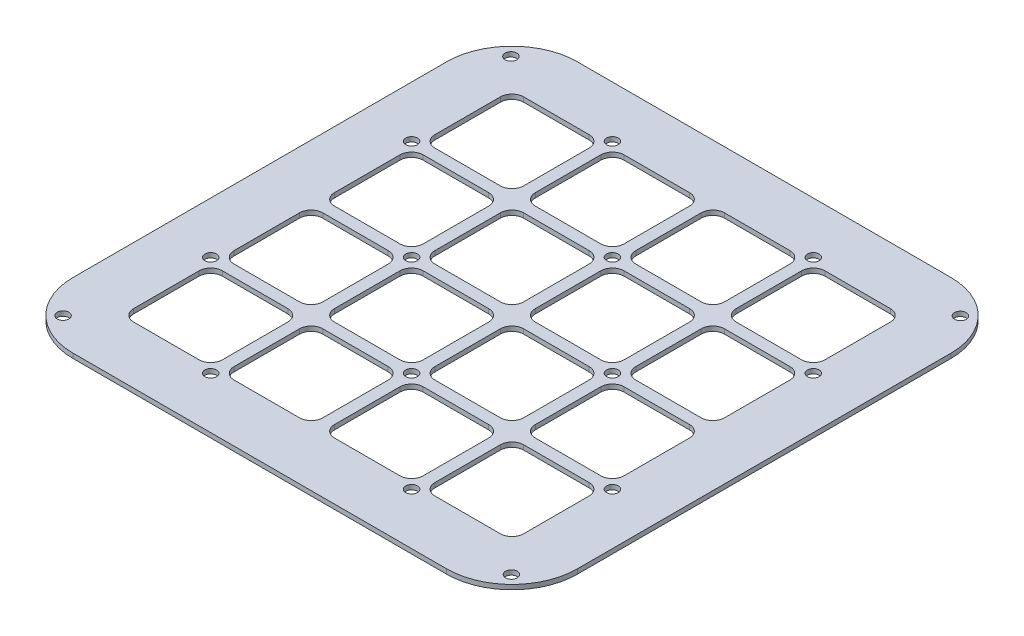
from build123d import *

# Parameters (mm, degrees)
BOSS_EXTRUDE1_DEPTH = 2
CUT_EXTRUDE1_REACH  = 154.836
SKETCH2_R           = 2.5
CUT_EXTRUDE3_REACH  = 154.836
SKETCH3_R           = 2.5


with BuildPart() as part:
    # Sketch1 → Boss-Extrude1 (new body)
    with BuildSketch(Plane(origin=(0, 0, 0), x_dir=(1, 0, 0), z_dir=(0, 1, 0))):
        with BuildLine():
            Line((80, 108.124355158), (-80, 108.124355158))
            ThreePointArc((-80, 108.124355158), (-99.798989873, 99.923345032), (-108, 80.124355158))
            Line((-108, 80.124355158), (-108, 70.124355158))
            Line((-108, 70.124355158), (-108, -79.875644842))
            ThreePointArc((-108, -79.875644842), (-99.798989873, -99.674634715), (-80, -107.875644842))
            Line((-80, -107.875644842), (80, -107.875644842))
            ThreePointArc((80, -107.875644842), (99.798989873, -99.674634715), (108, -79.875644842))
            Line((108, -79.875644842), (108, 70.124355158))
            Line((108, 70.124355158), (108, 80.124355158))
            ThreePointArc((108, 80.124355158), (99.798989873, 99.923345032), (80, 108.124355158))
        make_face()
        with BuildLine():
            Line((-35.5, 83.624355158), (-7.5, 83.624355158))
            ThreePointArc((-7.5, 83.624355158), (-3.964466094, 82.159889064), (-2.5, 78.624355158))
            Line((-2.5, 78.624355158), (-2.5, 50.624355158))
            ThreePointArc((-2.5, 50.624355158), (-3.964466094, 47.088821252), (-7.5, 45.624355158))
            Line((-7.5, 45.624355158), (-35.5, 45.624355158))
            ThreePointArc((-35.5, 45.624355158), (-39.035533906, 47.088821252), (-40.5, 50.624355158))
            Line((-40.5, 50.624355158), (-40.5, 78.624355158))
            ThreePointArc((-40.5, 78.624355158), (-39.035533906, 82.159889064), (-35.5, 83.624355158))
        make_face(mode=Mode.SUBTRACT)
        with BuildLine():
            Line((7.5, 83.624355158), (35.5, 83.624355158))
            ThreePointArc((35.5, 83.624355158), (39.035533906, 82.159889064), (40.5, 78.624355158))
            Line((40.5, 78.624355158), (40.5, 50.624355158))
            ThreePointArc((40.5, 50.624355158), (39.035533906, 47.088821252), (35.5, 45.624355158))
            Line((35.5, 45.624355158), (7.5, 45.624355158))
            ThreePointArc((7.5, 45.624355158), (3.964466094, 47.088821252), (2.5, 50.624355158))
            Line((2.5, 50.624355158), (2.5, 78.624355158))
            ThreePointArc((2.5, 78.624355158), (3.964466094, 82.159889064), (7.5, 83.624355158))
        make_face(mode=Mode.SUBTRACT)
        with BuildLine():
            Line((-78.5, 83.624355158), (-50.5, 83.624355158))
            ThreePointArc((-50.5, 83.624355158), (-46.964466094, 82.159889064), (-45.5, 78.624355158))
            Line((-45.5, 78.624355158), (-45.5, 50.624355158))
            ThreePointArc((-45.5, 50.624355158), (-46.964466094, 47.088821252), (-50.5, 45.624355158))
            Line((-50.5, 45.624355158), (-78.5, 45.624355158))
            ThreePointArc((-78.5, 45.624355158), (-82.035533906, 47.088821252), (-83.5, 50.624355158))
            Line((-83.5, 50.624355158), (-83.5, 78.624355158))
            ThreePointArc((-83.5, 78.624355158), (-82.035533906, 82.159889064), (-78.5, 83.624355158))
        make_face(mode=Mode.SUBTRACT)
        with BuildLine():
            Line((50.5, 83.624355158), (78.5, 83.624355158))
            ThreePointArc((78.5, 83.624355158), (82.035533906, 82.159889064), (83.5, 78.624355158))
            Line((83.5, 78.624355158), (83.5, 50.624355158))
            ThreePointArc((83.5, 50.624355158), (82.035533906, 47.088821252), (78.5, 45.624355158))
            Line((78.5, 45.624355158), (50.5, 45.624355158))
            ThreePointArc((50.5, 45.624355158), (46.964466094, 47.088821252), (45.5, 50.624355158))
            Line((45.5, 50.624355158), (45.5, 78.624355158))
            ThreePointArc((45.5, 78.624355158), (46.964466094, 82.159889064), (50.5, 83.624355158))
        make_face(mode=Mode.SUBTRACT)
        with BuildLine():
            Line((-35.5, 40.624355158), (-7.5, 40.624355158))
            ThreePointArc((-7.5, 40.624355158), (-3.964466094, 39.159889064), (-2.5, 35.624355158))
            Line((-2.5, 35.624355158), (-2.5, 7.624355158))
            ThreePointArc((-2.5, 7.624355158), (-3.964466094, 4.088821252), (-7.5, 2.624355158))
            Line((-7.5, 2.624355158), (-35.5, 2.624355158))
            ThreePointArc((-35.5, 2.624355158), (-39.035533906, 4.088821252), (-40.5, 7.624355158))
            Line((-40.5, 7.624355158), (-40.5, 35.624355158))
            ThreePointArc((-40.5, 35.624355158), (-39.035533906, 39.159889064), (-35.5, 40.624355158))
        make_face(mode=Mode.SUBTRACT)
        with BuildLine():
            Line((7.5, 40.624355158), (35.5, 40.624355158))
            ThreePointArc((35.5, 40.624355158), (39.035533906, 39.159889064), (40.5, 35.624355158))
            Line((40.5, 35.624355158), (40.5, 7.624355158))
            ThreePointArc((40.5, 7.624355158), (39.035533906, 4.088821252), (35.5, 2.624355158))
            Line((35.5, 2.624355158), (7.5, 2.624355158))
            ThreePointArc((7.5, 2.624355158), (3.964466094, 4.088821252), (2.5, 7.624355158))
            Line((2.5, 7.624355158), (2.5, 35.624355158))
            ThreePointArc((2.5, 35.624355158), (3.964466094, 39.159889064), (7.5, 40.624355158))
        make_face(mode=Mode.SUBTRACT)
        with BuildLine():
            Line((50.5, 40.624355158), (78.5, 40.624355158))
            ThreePointArc((78.5, 40.624355158), (82.035533906, 39.159889064), (83.5, 35.624355158))
            Line((83.5, 35.624355158), (83.5, 7.624355158))
            ThreePointArc((83.5, 7.624355158), (82.035533906, 4.088821252), (78.5, 2.624355158))
            Line((78.5, 2.624355158), (50.5, 2.624355158))
            ThreePointArc((50.5, 2.624355158), (46.964466094, 4.088821252), (45.5, 7.624355158))
            Line((45.5, 7.624355158), (45.5, 35.624355158))
            ThreePointArc((45.5, 35.624355158), (46.964466094, 39.159889064), (50.5, 40.624355158))
        make_face(mode=Mode.SUBTRACT)
        with BuildLine():
            Line((-35.5, -2.375644842), (-7.5, -2.375644842))
            ThreePointArc((-7.5, -2.375644842), (-3.964466094, -3.840110936), (-2.5, -7.375644842))
            Line((-2.5, -7.375644842), (-2.5, -35.375644842))
            ThreePointArc((-2.5, -35.375644842), (-3.964466094, -38.911178748), (-7.5, -40.375644842))
            Line((-7.5, -40.375644842), (-35.5, -40.375644842))
            ThreePointArc((-35.5, -40.375644842), (-39.035533906, -38.911178748), (-40.5, -35.375644842))
            Line((-40.5, -35.375644842), (-40.5, -7.375644842))
            ThreePointArc((-40.5, -7.375644842), (-39.035533906, -3.840110936), (-35.5, -2.375644842))
        make_face(mode=Mode.SUBTRACT)
        with BuildLine():
            Line((7.5, -2.375644842), (35.5, -2.375644842))
            ThreePointArc((35.5, -2.375644842), (39.035533906, -3.840110936), (40.5, -7.375644842))
            Line((40.5, -7.375644842), (40.5, -35.375644842))
            ThreePointArc((40.5, -35.375644842), (39.035533906, -38.911178748), (35.5, -40.375644842))
            Line((35.5, -40.375644842), (7.5, -40.375644842))
            ThreePointArc((7.5, -40.375644842), (3.964466094, -38.911178748), (2.5, -35.375644842))
            Line((2.5, -35.375644842), (2.5, -7.375644842))
            ThreePointArc((2.5, -7.375644842), (3.964466094, -3.840110936), (7.5, -2.375644842))
        make_face(mode=Mode.SUBTRACT)
        with BuildLine():
            Line((50.5, -2.375644842), (78.5, -2.375644842))
            ThreePointArc((78.5, -2.375644842), (82.035533906, -3.840110936), (83.5, -7.375644842))
            Line((83.5, -7.375644842), (83.5, -35.375644842))
            ThreePointArc((83.5, -35.375644842), (82.035533906, -38.911178748), (78.5, -40.375644842))
            Line((78.5, -40.375644842), (50.5, -40.375644842))
            ThreePointArc((50.5, -40.375644842), (46.964466094, -38.911178748), (45.5, -35.375644842))
            Line((45.5, -35.375644842), (45.5, -7.375644842))
            ThreePointArc((45.5, -7.375644842), (46.964466094, -3.840110936), (50.5, -2.375644842))
        make_face(mode=Mode.SUBTRACT)
        with BuildLine():
            Line((-35.5, -45.375644842), (-7.5, -45.375644842))
            ThreePointArc((-7.5, -45.375644842), (-3.964466094, -46.840110936), (-2.5, -50.375644842))
            Line((-2.5, -50.375644842), (-2.5, -78.375644842))
            ThreePointArc((-2.5, -78.375644842), (-3.964466094, -81.911178748), (-7.5, -83.375644842))
            Line((-7.5, -83.375644842), (-35.5, -83.375644842))
            ThreePointArc((-35.5, -83.375644842), (-39.035533906, -81.911178748), (-40.5, -78.375644842))
            Line((-40.5, -78.375644842), (-40.5, -50.375644842))
            ThreePointArc((-40.5, -50.375644842), (-39.035533906, -46.840110936), (-35.5, -45.375644842))
        make_face(mode=Mode.SUBTRACT)
        with BuildLine():
            Line((7.5, -45.375644842), (35.5, -45.375644842))
            ThreePointArc((35.5, -45.375644842), (39.035533906, -46.840110936), (40.5, -50.375644842))
            Line((40.5, -50.375644842), (40.5, -78.375644842))
            ThreePointArc((40.5, -78.375644842), (39.035533906, -81.911178748), (35.5, -83.375644842))
            Line((35.5, -83.375644842), (7.5, -83.375644842))
            ThreePointArc((7.5, -83.375644842), (3.964466094, -81.911178748), (2.5, -78.375644842))
            Line((2.5, -78.375644842), (2.5, -50.375644842))
            ThreePointArc((2.5, -50.375644842), (3.964466094, -46.840110936), (7.5, -45.375644842))
        make_face(mode=Mode.SUBTRACT)
        with BuildLine():
            Line((50.5, -45.375644842), (78.5, -45.375644842))
            ThreePointArc((78.5, -45.375644842), (82.035533906, -46.840110936), (83.5, -50.375644842))
            Line((83.5, -50.375644842), (83.5, -78.375644842))
            ThreePointArc((83.5, -78.375644842), (82.035533906, -81.911178748), (78.5, -83.375644842))
            Line((78.5, -83.375644842), (50.5, -83.375644842))
            ThreePointArc((50.5, -83.375644842), (46.964466094, -81.911178748), (45.5, -78.375644842))
            Line((45.5, -78.375644842), (45.5, -50.375644842))
            ThreePointArc((45.5, -50.375644842), (46.964466094, -46.840110936), (50.5, -45.375644842))
        make_face(mode=Mode.SUBTRACT)
        with BuildLine():
            Line((-78.5, 40.624355158), (-50.5, 40.624355158))
            ThreePointArc((-50.5, 40.624355158), (-46.964466094, 39.159889064), (-45.5, 35.624355158))
            Line((-45.5, 35.624355158), (-45.5, 7.624355158))
            ThreePointArc((-45.5, 7.624355158), (-46.964466094, 4.088821252), (-50.5, 2.624355158))
            Line((-50.5, 2.624355158), (-78.5, 2.624355158))
            ThreePointArc((-78.5, 2.624355158), (-82.035533906, 4.088821252), (-83.5, 7.624355158))
            Line((-83.5, 7.624355158), (-83.5, 35.624355158))
            ThreePointArc((-83.5, 35.624355158), (-82.035533906, 39.159889064), (-78.5, 40.624355158))
        make_face(mode=Mode.SUBTRACT)
        with BuildLine():
            Line((-78.5, -2.375644842), (-50.5, -2.375644842))
            ThreePointArc((-50.5, -2.375644842), (-46.964466094, -3.840110936), (-45.5, -7.375644842))
            Line((-45.5, -7.375644842), (-45.5, -35.375644842))
            ThreePointArc((-45.5, -35.375644842), (-46.964466094, -38.911178748), (-50.5, -40.375644842))
            Line((-50.5, -40.375644842), (-78.5, -40.375644842))
            ThreePointArc((-78.5, -40.375644842), (-82.035533906, -38.911178748), (-83.5, -35.375644842))
            Line((-83.5, -35.375644842), (-83.5, -7.375644842))
            ThreePointArc((-83.5, -7.375644842), (-82.035533906, -3.840110936), (-78.5, -2.375644842))
        make_face(mode=Mode.SUBTRACT)
        with BuildLine():
            Line((-78.5, -45.375644842), (-50.5, -45.375644842))
            ThreePointArc((-50.5, -45.375644842), (-46.964466094, -46.840110936), (-45.5, -50.375644842))
            Line((-45.5, -50.375644842), (-45.5, -78.375644842))
            ThreePointArc((-45.5, -78.375644842), (-46.964466094, -81.911178748), (-50.5, -83.375644842))
            Line((-50.5, -83.375644842), (-78.5, -83.375644842))
            ThreePointArc((-78.5, -83.375644842), (-82.035533906, -81.911178748), (-83.5, -78.375644842))
            Line((-83.5, -78.375644842), (-83.5, -50.375644842))
            ThreePointArc((-83.5, -50.375644842), (-82.035533906, -46.840110936), (-78.5, -45.375644842))
        make_face(mode=Mode.SUBTRACT)
    extrude(amount=BOSS_EXTRUDE1_DEPTH)

    # Sketch2 → Cut-Extrude1 (cut, up to next)
    with BuildSketch(Plane.XZ, mode=Mode.PRIVATE) as cut_extrude1_sk1:
        with Locations(Location((-43, -0.124355158, 0), (0, 0, 270))):
            Circle(SKETCH2_R)
    cut_extrude1_tool1 = extrude(cut_extrude1_sk1.sketch, amount=-CUT_EXTRUDE1_REACH, mode=Mode.PRIVATE) & part.part
    # Sketch2 → Cut-Extrude1 (cut, up to next)
    with BuildSketch(Plane.XZ, mode=Mode.PRIVATE) as cut_extrude1_sk2:
        with Locations(Location((43, -0.124355158, 0), (0, 0, 90))):
            Circle(SKETCH2_R)
    cut_extrude1_tool2 = extrude(cut_extrude1_sk2.sketch, amount=-CUT_EXTRUDE1_REACH, mode=Mode.PRIVATE) & part.part
    # Sketch2 → Cut-Extrude1 (cut, up to next)
    with BuildSketch(Plane.XZ, mode=Mode.PRIVATE) as cut_extrude1_sk3:
        with Locations(Location((0, 42.875644842, 0), (0, 0, 270))):
            Circle(SKETCH2_R)
    cut_extrude1_tool3 = extrude(cut_extrude1_sk3.sketch, amount=-CUT_EXTRUDE1_REACH, mode=Mode.PRIVATE) & part.part
    # Sketch2 → Cut-Extrude1 (cut, up to next)
    with BuildSketch(Plane.XZ, mode=Mode.PRIVATE) as cut_extrude1_sk4:
        with Locations(Location((0, -43.124355158, 0), (0, 0, 90))):
            Circle(SKETCH2_R)
    cut_extrude1_tool4 = extrude(cut_extrude1_sk4.sketch, amount=-CUT_EXTRUDE1_REACH, mode=Mode.PRIVATE) & part.part
    # Sketch2 → Cut-Extrude1 (cut, up to next)
    with BuildSketch(Plane.XZ, mode=Mode.PRIVATE) as cut_extrude1_sk5:
        with Locations(Location((-43, 85.875644842, 0), (0, 0, 270))):
            Circle(SKETCH2_R)
    cut_extrude1_tool5 = extrude(cut_extrude1_sk5.sketch, amount=-CUT_EXTRUDE1_REACH, mode=Mode.PRIVATE) & part.part
    # Sketch2 → Cut-Extrude1 (cut, up to next)
    with BuildSketch(Plane.XZ, mode=Mode.PRIVATE) as cut_extrude1_sk6:
        with Locations(Location((-86, 42.875644842, 0), (0, 0, 270))):
            Circle(SKETCH2_R)
    cut_extrude1_tool6 = extrude(cut_extrude1_sk6.sketch, amount=-CUT_EXTRUDE1_REACH, mode=Mode.PRIVATE) & part.part
    # Sketch2 → Cut-Extrude1 (cut, up to next)
    with BuildSketch(Plane.XZ, mode=Mode.PRIVATE) as cut_extrude1_sk7:
        with Locations(Location((86, 42.875644842, 0), (0, 0, 90))):
            Circle(SKETCH2_R)
    cut_extrude1_tool7 = extrude(cut_extrude1_sk7.sketch, amount=-CUT_EXTRUDE1_REACH, mode=Mode.PRIVATE) & part.part
    # Sketch2 → Cut-Extrude1 (cut, up to next)
    with BuildSketch(Plane.XZ, mode=Mode.PRIVATE) as cut_extrude1_sk8:
        with Locations(Location((43, 85.875644842, 0), (0, 0, 90))):
            Circle(SKETCH2_R)
    cut_extrude1_tool8 = extrude(cut_extrude1_sk8.sketch, amount=-CUT_EXTRUDE1_REACH, mode=Mode.PRIVATE) & part.part
    # Sketch2 → Cut-Extrude1 (cut, up to next)
    with BuildSketch(Plane.XZ, mode=Mode.PRIVATE) as cut_extrude1_sk9:
        with Locations(Location((86, -43.124355158, 0), (0, 0, 270))):
            Circle(SKETCH2_R)
    cut_extrude1_tool9 = extrude(cut_extrude1_sk9.sketch, amount=-CUT_EXTRUDE1_REACH, mode=Mode.PRIVATE) & part.part
    # Sketch2 → Cut-Extrude1 (cut, up to next)
    with BuildSketch(Plane.XZ, mode=Mode.PRIVATE) as cut_extrude1_sk10:
        with Locations(Location((43, -86.124355158, 0), (0, 0, 270))):
            Circle(SKETCH2_R)
    cut_extrude1_tool10 = extrude(cut_extrude1_sk10.sketch, amount=-CUT_EXTRUDE1_REACH, mode=Mode.PRIVATE) & part.part
    # Sketch2 → Cut-Extrude1 (cut, up to next)
    with BuildSketch(Plane.XZ, mode=Mode.PRIVATE) as cut_extrude1_sk11:
        with Locations(Location((-43, -86.124355158, 0), (0, 0, 90))):
            Circle(SKETCH2_R)
    cut_extrude1_tool11 = extrude(cut_extrude1_sk11.sketch, amount=-CUT_EXTRUDE1_REACH, mode=Mode.PRIVATE) & part.part
    # Sketch2 → Cut-Extrude1 (cut, up to next)
    with BuildSketch(Plane.XZ, mode=Mode.PRIVATE) as cut_extrude1_sk12:
        with Locations(Location((-86, -43.124355158, 0), (0, 0, 90))):
            Circle(SKETCH2_R)
    cut_extrude1_tool12 = extrude(cut_extrude1_sk12.sketch, amount=-CUT_EXTRUDE1_REACH, mode=Mode.PRIVATE) & part.part
    add(cut_extrude1_tool1.solids().sort_by_distance((-43, 0, -0.124355))[0], mode=Mode.SUBTRACT)
    add(cut_extrude1_tool2.solids().sort_by_distance((43, 0, -0.124355))[0], mode=Mode.SUBTRACT)
    add(cut_extrude1_tool3.solids().sort_by_distance((0, 0, 42.875645))[0], mode=Mode.SUBTRACT)
    add(cut_extrude1_tool4.solids().sort_by_distance((0, 0, -43.124355))[0], mode=Mode.SUBTRACT)
    add(cut_extrude1_tool5.solids().sort_by_distance((-43, 0, 85.875645))[0], mode=Mode.SUBTRACT)
    add(cut_extrude1_tool6.solids().sort_by_distance((-86, 0, 42.875645))[0], mode=Mode.SUBTRACT)
    add(cut_extrude1_tool7.solids().sort_by_distance((86, 0, 42.875645))[0], mode=Mode.SUBTRACT)
    add(cut_extrude1_tool8.solids().sort_by_distance((43, 0, 85.875645))[0], mode=Mode.SUBTRACT)
    add(cut_extrude1_tool9.solids().sort_by_distance((86, 0, -43.124355))[0], mode=Mode.SUBTRACT)
    add(cut_extrude1_tool10.solids().sort_by_distance((43, 0, -86.124355))[0], mode=Mode.SUBTRACT)
    add(cut_extrude1_tool11.solids().sort_by_distance((-43, 0, -86.124355))[0], mode=Mode.SUBTRACT)
    add(cut_extrude1_tool12.solids().sort_by_distance((-86, 0, -43.124355))[0], mode=Mode.SUBTRACT)

    # Sketch3 → Cut-Extrude3 (cut, up to next)
    with BuildSketch(Plane.XZ, mode=Mode.PRIVATE) as cut_extrude3_sk1:
        with Locations(Location((-96, 96.110601557, 0), (0, 0, 270))):
            Circle(SKETCH3_R)
    cut_extrude3_tool1 = extrude(cut_extrude3_sk1.sketch, amount=-CUT_EXTRUDE3_REACH, mode=Mode.PRIVATE) & part.part
    # Sketch3 → Cut-Extrude3 (cut, up to next)
    with BuildSketch(Plane.XZ, mode=Mode.PRIVATE) as cut_extrude3_sk2:
        with Locations(Location((-96.22107569, -95.889271166, 0), (0, 0, 90))):
            Circle(SKETCH3_R)
    cut_extrude3_tool2 = extrude(cut_extrude3_sk2.sketch, amount=-CUT_EXTRUDE3_REACH, mode=Mode.PRIVATE) & part.part
    # Sketch3 → Cut-Extrude3 (cut, up to next)
    with BuildSketch(Plane.XZ, mode=Mode.PRIVATE) as cut_extrude3_sk3:
        with Locations(Location((96.22107569, -95.889271166, 0), (0, 0, 270))):
            Circle(SKETCH3_R)
    cut_extrude3_tool3 = extrude(cut_extrude3_sk3.sketch, amount=-CUT_EXTRUDE3_REACH, mode=Mode.PRIVATE) & part.part
    # Sketch3 → Cut-Extrude3 (cut, up to next)
    with BuildSketch(Plane.XZ, mode=Mode.PRIVATE) as cut_extrude3_sk4:
        with Locations(Location((96, 96.110601557, 0), (0, 0, 90))):
            Circle(SKETCH3_R)
    cut_extrude3_tool4 = extrude(cut_extrude3_sk4.sketch, amount=-CUT_EXTRUDE3_REACH, mode=Mode.PRIVATE) & part.part
    add(cut_extrude3_tool1.solids().sort_by_distance((-96, 0, 96.110602))[0], mode=Mode.SUBTRACT)
    add(cut_extrude3_tool2.solids().sort_by_distance((-96.221076, 0, -95.889271))[0], mode=Mode.SUBTRACT)
    add(cut_extrude3_tool3.solids().sort_by_distance((96.221076, 0, -95.889271))[0], mode=Mode.SUBTRACT)
    add(cut_extrude3_tool4.solids().sort_by_distance((96, 0, 96.110602))[0], mode=Mode.SUBTRACT)


solid = part.part
